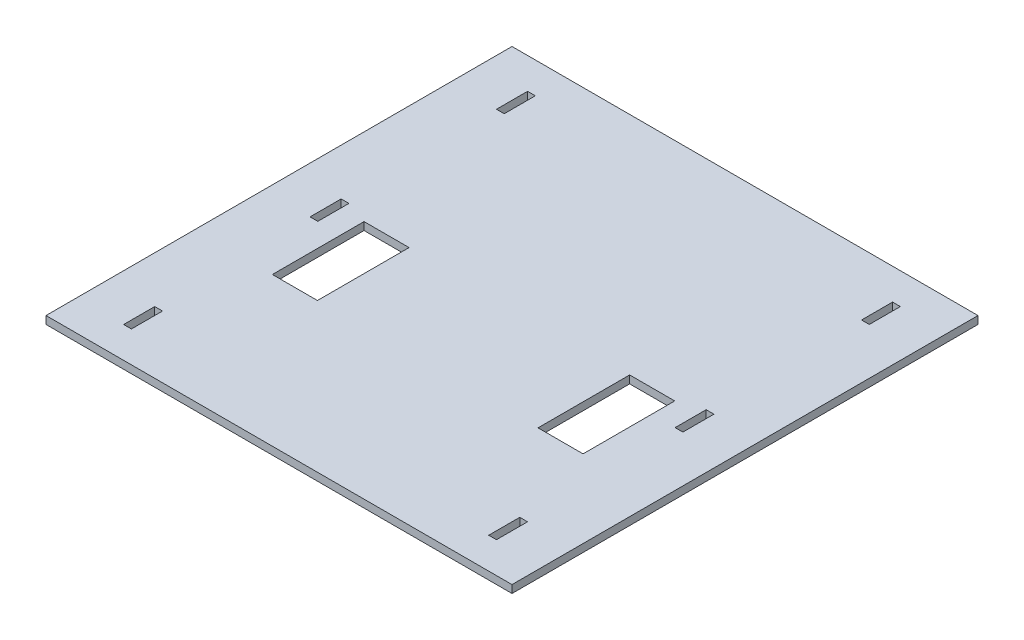
from build123d import *

# Parameters (mm, degrees)
SKETCH1_W           = 300
SKETCH1_H           = 300
BOSS_EXTRUDE1_DEPTH = 5
SKETCH2_W           = 29
SKETCH2_H           = 59
CUT_EXTRUDE1_DEPTH  = 5
SKETCH3_W           = 5
SKETCH3_H           = 20
CUT_EXTRUDE2_DEPTH  = 5


with BuildPart() as part:
    # Sketch1 → Boss-Extrude1 (new body)
    with BuildSketch(Plane(origin=(0, 0, 0), x_dir=(1, 0, 0), z_dir=(0, 1, 0))):
        with Locations((150, 150)):
            Rectangle(SKETCH1_W, SKETCH1_H)
    extrude(amount=BOSS_EXTRUDE1_DEPTH)

    # Sketch2 → Cut-Extrude1 (cut)
    with BuildSketch(Plane(origin=(0, 5, 0), x_dir=(1, 0, 0), z_dir=(0, 1, 0))):
        with Locations((235.5, 125.25)):
            Rectangle(SKETCH2_W, SKETCH2_H)
        with Locations((64.5, 125.25)):
            Rectangle(SKETCH2_W, SKETCH2_H)
    extrude(amount=-CUT_EXTRUDE1_DEPTH, mode=Mode.SUBTRACT)

    # Sketch3 → Cut-Extrude2 (cut)
    with BuildSketch(Plane(origin=(0, 5, 0), x_dir=(1, 0, 0), z_dir=(0, 1, 0))):
        with Locations((267.5, 30)):
            Rectangle(SKETCH3_W, SKETCH3_H)
        with Locations((267.5, 150)):
            Rectangle(SKETCH3_W, SKETCH3_H)
        with Locations((267.5, 270)):
            Rectangle(SKETCH3_W, SKETCH3_H)
        with Locations((32.5, 30)):
            Rectangle(SKETCH3_W, SKETCH3_H)
        with Locations((32.5, 150)):
            Rectangle(SKETCH3_W, SKETCH3_H)
        with Locations((32.5, 270)):
            Rectangle(SKETCH3_W, SKETCH3_H)
    extrude(amount=-CUT_EXTRUDE2_DEPTH, mode=Mode.SUBTRACT)


solid = part.part
